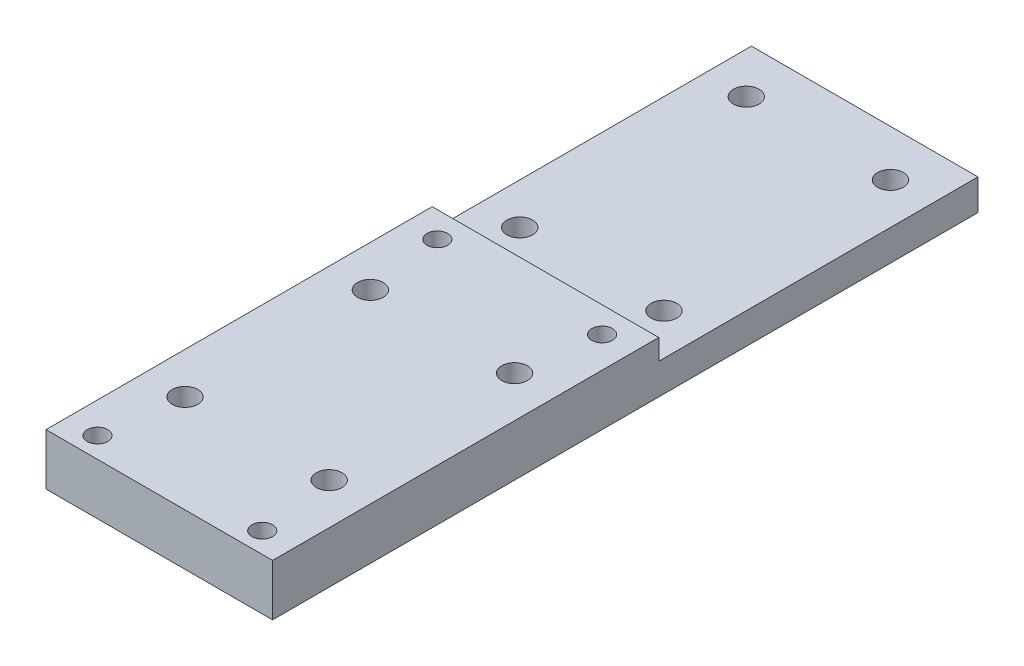
from build123d import *

# Parameters (mm, degrees)
SKETCH1_W           = 44
SKETCH1_H           = 137
SKETCH1_R           = 2.5
SKETCH1_R_2         = 2
BOSS_EXTRUDE1_DEPTH = 10
SKETCH2_W           = 62
SKETCH2_H           = 4
CUT_EXTRUDE1_DEPTH  = 83.025910541


with BuildPart() as part:
    # Sketch1 → Boss-Extrude1 (new body)
    with BuildSketch(Plane(origin=(0, 0, 0), x_dir=(1, 0, 0), z_dir=(0, 1, 0))):
        Rectangle(SKETCH1_W, SKETCH1_H)
        with Locations(Location((-14, 59.5, 0), (0, 0, 270))):
            Circle(SKETCH1_R, mode=Mode.SUBTRACT)
        with Locations(Location((14, 59.5, 0), (0, 0, 270))):
            Circle(SKETCH1_R, mode=Mode.SUBTRACT)
        with Locations(Location((14, 15.5, 0), (0, 0, 270))):
            Circle(SKETCH1_R, mode=Mode.SUBTRACT)
        with Locations(Location((-14, 15.5, 0), (0, 0, 270))):
            Circle(SKETCH1_R, mode=Mode.SUBTRACT)
        with Locations(Location((14, -13.5, 0), (0, 0, 270))):
            Circle(SKETCH1_R, mode=Mode.SUBTRACT)
        with Locations(Location((-14, -13.5, 0), (0, 0, 270))):
            Circle(SKETCH1_R, mode=Mode.SUBTRACT)
        with Locations(Location((-14, -49.5, 0), (0, 0, 270))):
            Circle(SKETCH1_R, mode=Mode.SUBTRACT)
        with Locations(Location((14, -49.5, 0), (0, 0, 270))):
            Circle(SKETCH1_R, mode=Mode.SUBTRACT)
        with Locations(Location((-16, 1.5, 0), (0, 0, 270))):
            Circle(SKETCH1_R_2, mode=Mode.SUBTRACT)
        with Locations(Location((16, 1.5, 0), (0, 0, 270))):
            Circle(SKETCH1_R_2, mode=Mode.SUBTRACT)
        with Locations(Location((-16, -64.5, 0), (0, 0, 270))):
            Circle(SKETCH1_R_2, mode=Mode.SUBTRACT)
        with Locations(Location((16, -64.5, 0), (0, 0, 270))):
            Circle(SKETCH1_R_2, mode=Mode.SUBTRACT)
    extrude(amount=BOSS_EXTRUDE1_DEPTH)

    # Sketch2 → Cut-Extrude1 (cut, through all)
    with BuildSketch(Plane(origin=(22, 0, 0), x_dir=(0, 0, -1), z_dir=(1, 0, 0))):
        with Locations((37.5, 8)):
            Rectangle(SKETCH2_W, SKETCH2_H)
    extrude(amount=-CUT_EXTRUDE1_DEPTH, mode=Mode.SUBTRACT)


solid = part.part
